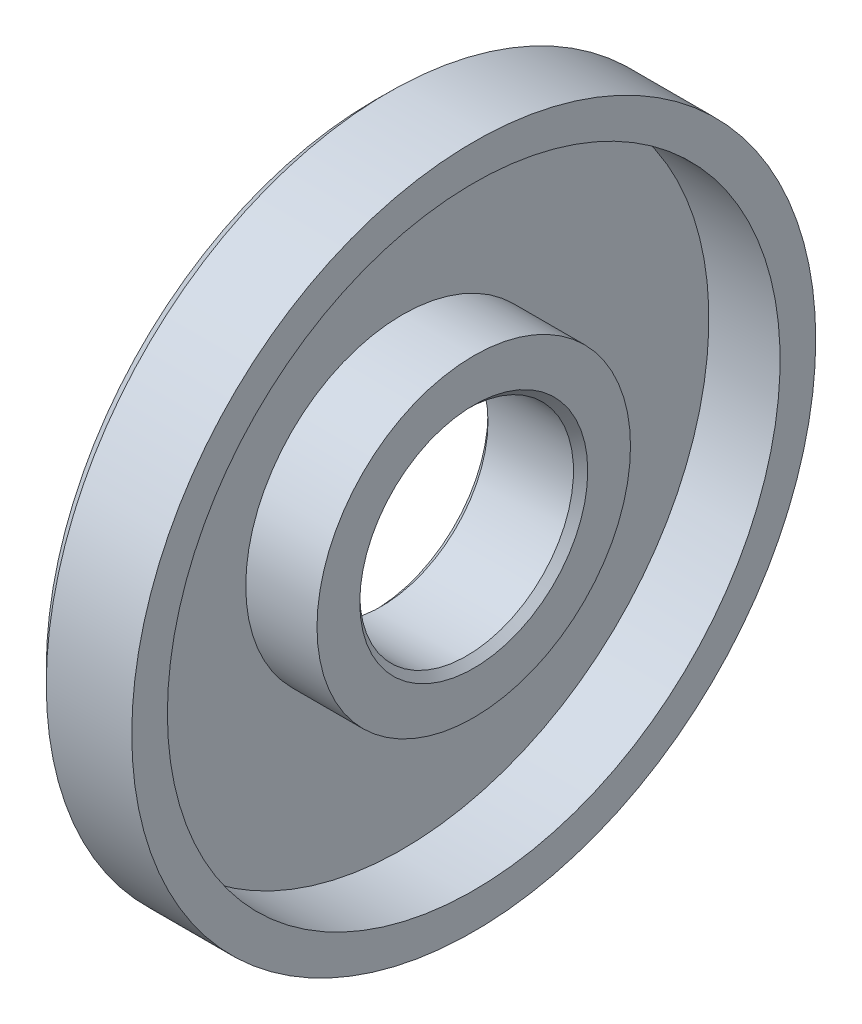
from build123d import *

# Parameters (mm, degrees)
CHAMFER_1_SIZE = 1
CHAMFER_2_SIZE = 0.5


with BuildPart() as part:
    # Эскиз1 → Повернуть1 (revolve)
    with BuildSketch(Plane.XY, mode=Mode.PRIVATE) as revolve_1_sk:
        Polygon((7, 21.5), (2, 21.5), (2, 11), (7, 11), (7, 7.5), (0, 7.5), (0, 24), (7, 24), align=None)
    revolve(revolve_1_sk.sketch.rotate(Axis((0, 0, 0), (1, 0, 0)), 90), axis=Axis((0, 0, 0), (1, 0, 0)))

    # Фаска1
    chamfer_1_edges = [part.edges().sort_by_distance(p)[0] for p in [
        (0, 0, -24),
    ]]
    chamfer(chamfer_1_edges, length=CHAMFER_1_SIZE)

    # Фаска2
    chamfer_2_edges = [part.edges().sort_by_distance(p)[0] for p in [
        (7, 0, -7.5),
        (0, 0, -7.5),
    ]]
    chamfer(chamfer_2_edges, length=CHAMFER_2_SIZE)


solid = part.part
